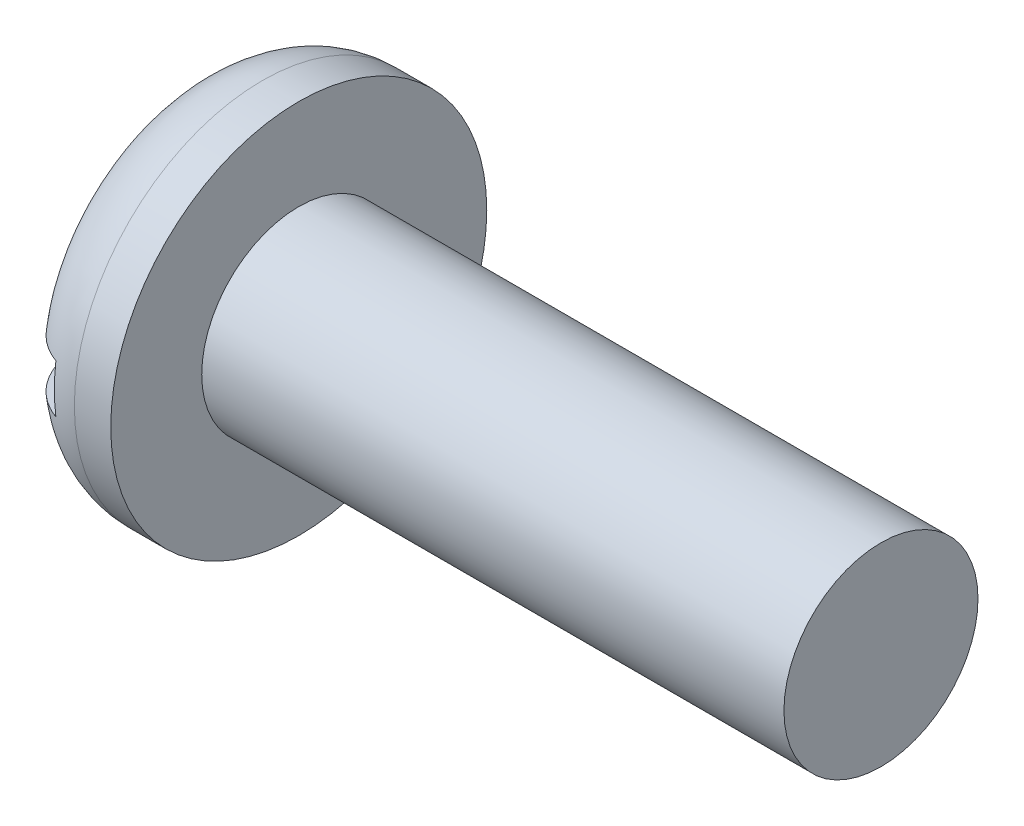
from build123d import *

# Parameters (mm, degrees)
SKETCH2_W          = 12.190003068
SKETCH2_H          = 1
CUT_EXTRUDE1_DEPTH = 1


with BuildPart() as part:
    # Sketch1 → Revolve1 (revolve)
    with BuildSketch(Plane.XY, mode=Mode.PRIVATE) as revolve1_sk:
        with BuildLine():
            Line((0, 0), (14.25, 0))
            Line((14.25, 0), (14.25, 2))
            Line((14.25, 2), (2.25, 2))
            Line((2.25, 2), (2.25, 3.875))
            Line((2.25, 3.875), (1.5, 3.875))
            ThreePointArc((1.5, 3.875), (0.439339828, 3.435660172), (0, 2.375))
            Line((0, 2.375), (0, 0))
        make_face()
    revolve(revolve1_sk.sketch.rotate(Axis((0, 0, 0), (-1, 0, 0)), 90), axis=Axis((0, 0, 0), (-1, 0, 0)))

    # Sketch2 → Cut-Extrude1 (cut)
    with BuildSketch(Plane.ZY):
        Rectangle(SKETCH2_W, SKETCH2_H)
    extrude(amount=-CUT_EXTRUDE1_DEPTH, mode=Mode.SUBTRACT)


solid = part.part
